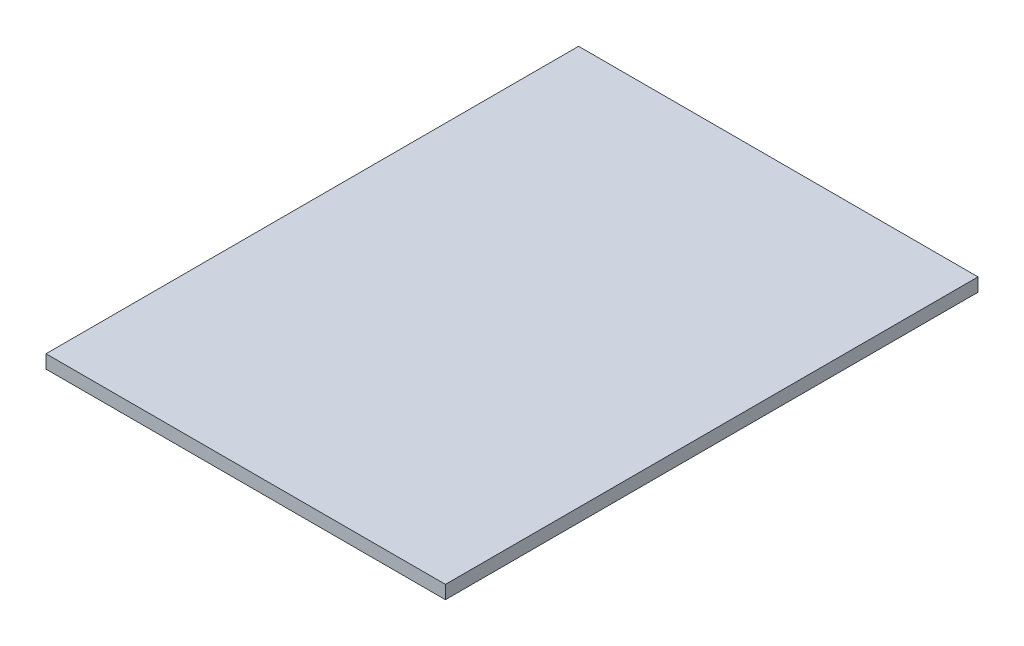
from build123d import *

# Parameters (mm, degrees)
ESQUISSE1_W        = 600
ESQUISSE1_H        = 800
BOSS_EXTRU_1_DEPTH = 20


with BuildPart() as part:
    # Esquisse1 → Boss.-Extru.1 (new body)
    with BuildSketch(Plane(origin=(0, 0, 0), x_dir=(1, 0, 0), z_dir=(0, 1, 0))):
        with Locations((300, 400)):
            Rectangle(ESQUISSE1_W, ESQUISSE1_H)
    extrude(amount=BOSS_EXTRU_1_DEPTH)


solid = part.part
